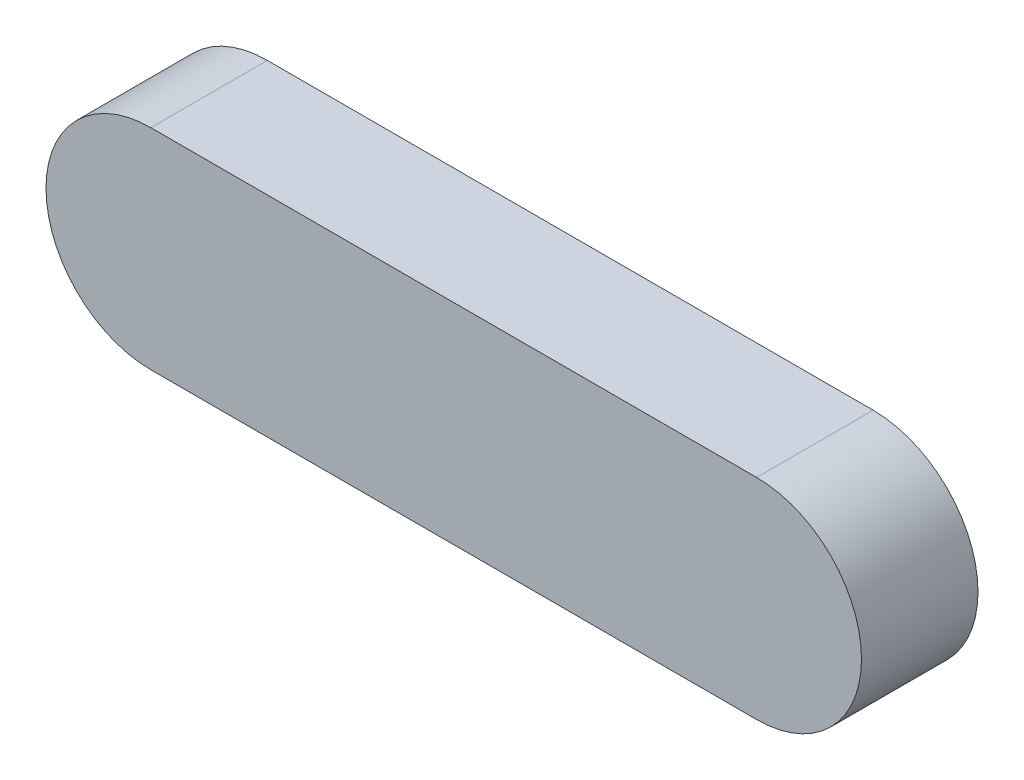
from build123d import *

# Parameters (mm, degrees)
EXTRUDE_1_DEPTH = 20


with BuildPart() as part:
    # 草图1 → 拉伸1 (new body)
    with BuildSketch(Plane.XY):
        with BuildLine():
            Line((-52, 18), (52, 18))
            ThreePointArc((52, 18), (70, 0), (52, -18))
            Line((52, -18), (-52, -18))
            ThreePointArc((-52, -18), (-70, 0), (-52, 18))
        make_face()
    extrude(amount=EXTRUDE_1_DEPTH)


solid = part.part
